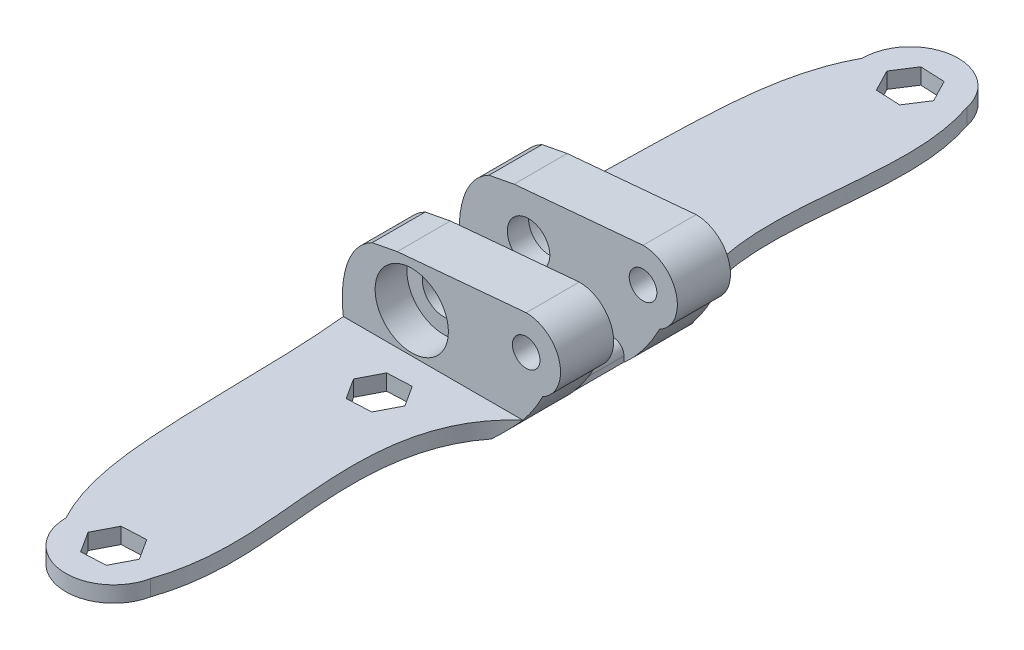
from build123d import *

# Parameters (mm, degrees)
SKETCH1_R           = 6.9
SKETCH1_R_2         = 2.6
BOSS_EXTRUDE1_DEPTH = 10
BOSS_EXTRUDE2_DEPTH = 12
SKETCH3_R           = 7
SKETCH3_R_2         = 4
BOSS_EXTRUDE3_DEPTH = 4
BOSS_EXTRUDE4_DEPTH = 84
BOSS_EXTRUDE5_DEPTH = 84
CUT_EXTRUDE1_DEPTH  = 190.323263107


with BuildPart() as part:
    # Sketch1 → Boss-Extrude1 (new body)
    with BuildSketch(Plane.XY):
        with BuildLine():
            Line((-155.070766667, -34.03543395), (-139.182010536, -34.03543395))
            Line((-139.182010536, -34.03543395), (-124.735717634, -34.03543395))
            add(Edge.make_bspline(
                [(-124.735717634, -34.03543395), (-120.868070652, -30.634901056), (-118.110731489, -25.337058748)],
                knots=[0.604913823, 0.604913823, 0.604913823, 1, 1, 1], degree=2))
            ThreePointArc((-118.110731489, -25.337058748), (-114.956411592, -18.057608365), (-121.224300514, -13.194101363))
            Line((-121.224300514, -13.194101363), (-122.374915538, -13.297224598))
            Line((-122.374915538, -13.297224598), (-145.504342678, -15.370186717))
            add(Edge.make_bspline(
                [(-145.504342678, -15.370186717), (-147.665446471, -15.751951197), (-150.237941893, -16.278752791)],
                knots=[0, 0, 0, 0.143499102, 0.143499102, 0.143499102], degree=2))
            add(Edge.make_bspline(
                [(-150.237941893, -16.278752791), (-156.331446907, -19.412430802), (-156.587305002, -28.504886835), (-155.070766667, -34.03543395)],
                knots=[0, 0, 0, 0, 1, 1, 1, 1], degree=3))
        make_face()
        with Locations((-142.777717077, -23.619181221)):
            Circle(SKETCH1_R, mode=Mode.SUBTRACT)
        with Locations((-121.224300514, -19.664754316)):
            Circle(SKETCH1_R_2, mode=Mode.SUBTRACT)
    boss_extrude1 = extrude(amount=BOSS_EXTRUDE1_DEPTH)

    # Sketch2 → Boss-Extrude2 (add)
    with BuildSketch(Plane(origin=(0, 0, 0), x_dir=(-1, 0, 0), z_dir=(0, 0, -1))):
        with BuildLine():
            Line((124.810828249, -34.03543395), (124.810828249, -33.03543395))
            ThreePointArc((124.810828249, -33.03543395), (125.396614687, -31.621220388), (126.810828249, -31.03543395))
            Line((126.810828249, -31.03543395), (155.660238601, -31.03543395))
            add(Edge.make_bspline(
                [(155.660238601, -31.03543395), (155.453340821, -32.220849379), (155.070766667, -34.03543395)],
                knots=[0.469279702, 0.469279702, 0.469279702, 1.113861257, 1.113861257, 1.113861257], degree=2))
            Line((155.070766667, -34.03543395), (124.810828249, -34.03543395))
        make_face()
    extrude(amount=BOSS_EXTRUDE2_DEPTH)

    # Mirror1: Boss-Extrude1 across plane
    add(boss_extrude1.mirror(Plane(origin=(0, 0, -6), x_dir=(1, 0, 0), z_dir=(0, 0, -1))))

    # Sketch3 → Boss-Extrude3 (add)
    with BuildSketch(Plane(origin=(0, 0, 0), x_dir=(-1, 0, 0), z_dir=(0, 0, -1))):
        with Locations((142.777717077, -23.619181221)):
            Circle(SKETCH3_R)
        with Locations((142.777717077, -23.619181221)):
            Circle(SKETCH3_R_2, mode=Mode.SUBTRACT)
    boss_extrude3 = extrude(amount=-BOSS_EXTRUDE3_DEPTH)

    # Mirror2: Boss-Extrude3 across plane
    add(boss_extrude3.mirror(Plane(origin=(0, 0, -6), x_dir=(1, 0, 0), z_dir=(0, 0, -1))))

    # Sketch4 → Boss-Extrude4 (add)
    with BuildSketch(Plane.XY.offset(10)):
        with BuildLine():
            add(Edge.make_bspline(
                [(-155.660238601, -31.03543395), (-155.52477055, -32.104378324), (-155.322110933, -33.11882586), (-155.070766667, -34.03543395)],
                knots=[0.834264482, 0.834264482, 0.834264482, 0.834264482, 1, 1, 1, 1], degree=3))
            Line((-155.070766667, -34.03543395), (-124.735717634, -34.03543395))
            add(Edge.make_bspline(
                [(-124.735717634, -34.03543395), (-123.199822379, -32.685036057), (-121.8390218, -31.03543395)],
                knots=[0, 0, 0, 1, 1, 1], degree=2))
            Line((-121.8390218, -31.03543395), (-155.660238601, -31.03543395))
        make_face()
    extrude(amount=BOSS_EXTRUDE4_DEPTH)

    # Sketch5 → Boss-Extrude5 (add)
    with BuildSketch(Plane(origin=(0, 0, -22), x_dir=(-1, 0, 0), z_dir=(0, 0, -1))):
        with BuildLine():
            Line((155.070766667, -34.03543395), (124.735717633, -34.035433949))
            add(Edge.make_bspline(
                [(124.735717633, -34.035433949), (123.199822378, -32.685036056), (121.8390218, -31.03543395)],
                knots=[0, 0, 0, 1, 1, 1], degree=2))
            Line((121.8390218, -31.03543395), (155.660238601, -31.03543395))
            add(Edge.make_bspline(
                [(155.660238601, -31.03543395), (155.52477055, -32.104378324), (155.322110933, -33.11882586), (155.070766667, -34.03543395)],
                knots=[0.834264482, 0.834264482, 0.834264482, 0.834264482, 1, 1, 1, 1], degree=3))
        make_face()
    extrude(amount=BOSS_EXTRUDE5_DEPTH)

    # Sketch6 → Cut-Extrude1 (cut, through all)
    with BuildSketch(Plane(origin=(0, -31.03543395, 0), x_dir=(1, 0, 0), z_dir=(0, 1, 0))):
        Polygon((-137.786415389, 76.894835229), (-142.400005748, 77.114191864), (-144.516832509, 81.219356636), (-142.02006891, 85.105164771), (-137.406478551, 84.885808136), (-135.289651791, 80.780643364), align=None)
        Polygon((-135.289651791, 30.780643364), (-137.786415389, 26.894835229), (-142.400005748, 27.114191864), (-144.516832509, 31.219356636), (-142.02006891, 35.105164771), (-137.406478551, 34.885808136), align=None)
        with BuildLine():
            Line((-155.6602386, 22), (-173.465321409, 22))
            Line((-173.465321409, 22), (-173.465321409, 117.834139367))
            Line((-173.465321409, 117.834139367), (-100.430925903, 117.834139367))
            Line((-100.430925903, 117.834139367), (-121.8390218, 22))
            add(Edge.make_bspline(
                [(-121.8390218, 22), (-130.237957541, 29.288236007), (-131.708688401, 51.819501052), (-127.475857655, 72.230953717), (-131.071963897, 82.863468574)],
                knots=[0, 0, 0, 0, 0.490729359, 1, 1, 1, 1], degree=3))
            ThreePointArc((-131.071963897, 82.863468574), (-140.840035974, 89.976993263), (-148.928982602, 81))
            add(Edge.make_bspline(
                [(-148.928982602, 81), (-152.625386512, 74.081760345), (-155.262352814, 54.105117148), (-154.402874629, 34.24459948), (-155.6602386, 22)],
                knots=[0, 0, 0, 0, 0.385424941, 1, 1, 1, 1], degree=3))
        make_face()
        with BuildLine():
            Line((-100.430925903, -105.834139367), (-121.8390218, -10))
            add(Edge.make_bspline(
                [(-121.8390218, -10), (-130.237957541, -17.288236007), (-131.708688401, -39.819501052), (-127.475857655, -60.230953717), (-131.071963897, -70.863468574)],
                knots=[0, 0, 0, 0, 0.490729359, 1, 1, 1, 1], degree=3))
            ThreePointArc((-131.071963897, -70.863468574), (-140.840035974, -77.976993263), (-148.928982602, -69))
            add(Edge.make_bspline(
                [(-148.928982602, -69), (-152.625386512, -62.081760345), (-155.262352814, -42.105117148), (-154.402874629, -22.24459948), (-155.6602386, -10)],
                knots=[0, 0, 0, 0, 0.385424941, 1, 1, 1, 1], degree=3))
            Line((-155.6602386, -10), (-173.465321409, -10))
            Line((-173.465321409, -10), (-173.465321409, -105.834139367))
            Line((-173.465321409, -105.834139367), (-100.430925903, -105.834139367))
        make_face()
        Polygon((-142.02006891, -23.105164771), (-137.406478551, -22.885808136), (-135.289651791, -18.780643364), (-137.786415389, -14.894835229), (-142.400005748, -15.114191864), (-144.516832509, -19.219356636), align=None)
        Polygon((-135.289651791, -68.780643364), (-137.786415389, -64.894835229), (-142.400005748, -65.114191864), (-144.516832509, -69.219356636), (-142.02006891, -73.105164771), (-137.406478551, -72.885808136), align=None)
    extrude(amount=-CUT_EXTRUDE1_DEPTH, mode=Mode.SUBTRACT)


solid = part.part
